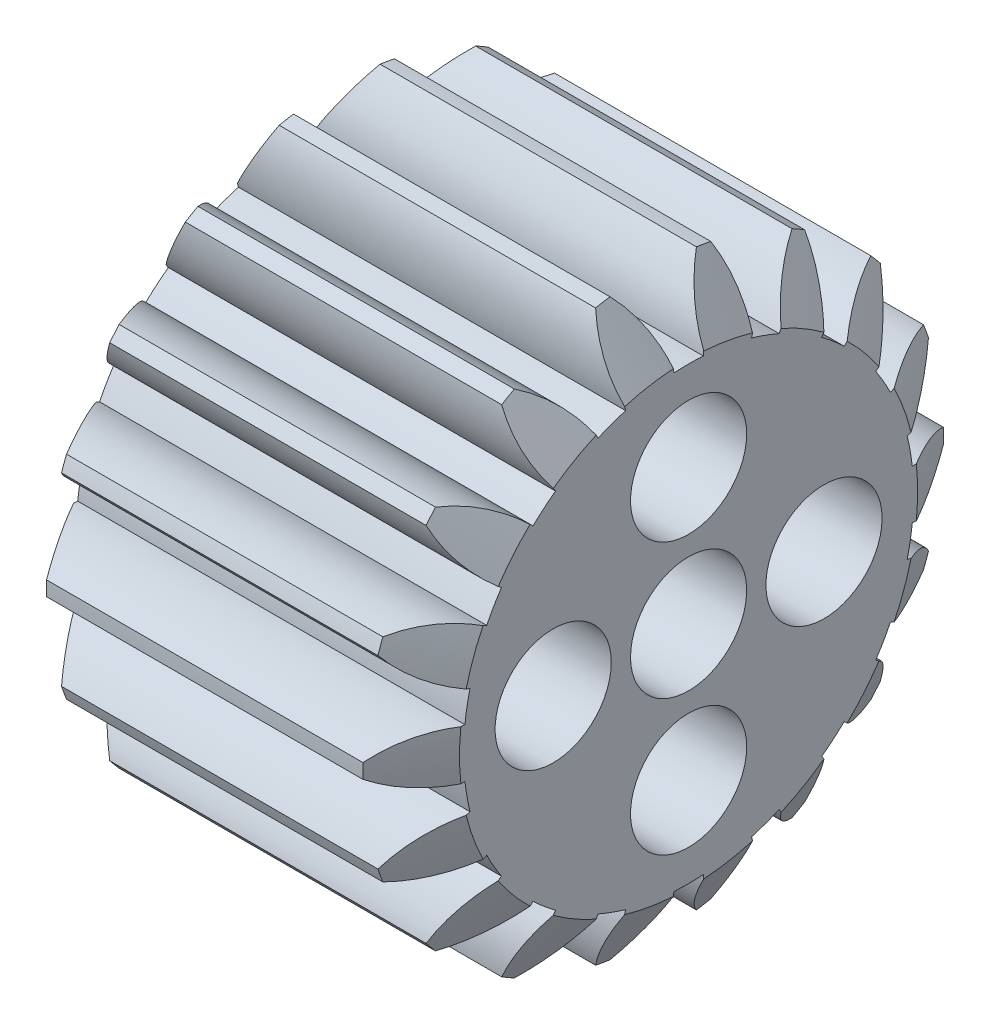
from build123d import *

# Parameters (mm, degrees)
BASPROSKE_W        = 20
BASPROSKE_H        = 15
TOOTHCUT_DEPTH     = 30.154759474
TEETHCUTS_COUNT    = 18
TEETHCUTS_ANGLE    = 340
BORSKE_R           = 3
BORE_DEPTH         = 50.0000508
SKETCH1_R          = 1.75
CUT_EXTRUDE1_DEPTH = 20
SKETCH1_5_R        = 3
SKETCH1_5_R_2      = 1.75
CUT_EXTRUDE3_DEPTH = 15


with BuildPart() as part:
    # BasProSke → Base-Revolve (revolve)
    with BuildSketch(Plane(origin=(0, 0, 0), x_dir=(1, 0, 0), z_dir=(0, 1, 0))):
        with Locations((10, 7.5)):
            Rectangle(BASPROSKE_W, BASPROSKE_H)
    revolve(axis=Axis((-10, 0, 0), (1, 0, 0)))

    # TooCutSke → ToothCut (cut, through all)
    with BuildSketch(Plane(origin=(0, 0, 0), x_dir=(0, 0, -1), z_dir=(1, 0, 0))):
        with BuildLine():
            ThreePointArc((0.759974923, 11.599129886), (0, 11.624), (-0.759974923, 11.599129886))
            ThreePointArc((-0.759974923, 11.599129886), (-1.229186471, 13.354767823), (-2.254227748, 14.855339189))
            ThreePointArc((-2.254227748, 14.855339189), (0, 15.0254), (2.254227748, 14.855339189))
            ThreePointArc((2.254227748, 14.855339189), (1.229186471, 13.354767823), (0.759974923, 11.599129886))
        make_face()
    toothcut = extrude(amount=TOOTHCUT_DEPTH, mode=Mode.SUBTRACT)

    # TeethCuts: ToothCut ×18 about axis
    teethcuts_axis = Axis((-10, 0, 0), (1, 0, 0))
    for i in range(1, TEETHCUTS_COUNT):
        add(toothcut.rotate(teethcuts_axis, i * TEETHCUTS_ANGLE / (TEETHCUTS_COUNT - 1)), mode=Mode.SUBTRACT)

    # BorSke → Bore (cut, symmetric)
    with BuildSketch(Plane(origin=(0, 0, 0), x_dir=(0, 0, -1), z_dir=(1, 0, 0))):
        Circle(BORSKE_R)
    extrude(amount=BORE_DEPTH, both=True, mode=Mode.SUBTRACT)

    # Sketch1 → Cut-Extrude1 (cut)
    with BuildSketch(Plane(origin=(20, 0, 0), x_dir=(0, 0, -1), z_dir=(1, 0, 0))):
        with Locations((6.994644099, -0.273825031)):
            Circle(SKETCH1_R)
        with Locations((-6.994644099, 0.273825031)):
            Circle(SKETCH1_R)
        with Locations((0, 7.000001873)):
            Circle(SKETCH1_R)
        with Locations((0, -7.000001873)):
            Circle(SKETCH1_R)
    extrude(amount=-CUT_EXTRUDE1_DEPTH, mode=Mode.SUBTRACT)

    # Sketch1<5> → Cut-Extrude3 (cut)
    # profile 1 of 4: a face of its own
    with BuildSketch(Plane(origin=(20, 0, 0), x_dir=(0, 0, -1), z_dir=(1, 0, 0))):
        with Locations((0, -7.000001873)):
            Circle(SKETCH1_5_R)
        with Locations((0, -7.000001873)):
            Circle(SKETCH1_5_R_2, mode=Mode.SUBTRACT)
    # profile 2 of 4: a face of its own
    with BuildSketch(Plane(origin=(20, 0, 0), x_dir=(0, 0, -1), z_dir=(1, 0, 0))):
        with Locations((6.994644099, -0.273825031)):
            Circle(SKETCH1_5_R)
        with Locations((6.994644099, -0.273825031)):
            Circle(SKETCH1_5_R_2, mode=Mode.SUBTRACT)
    # profile 3 of 4: a face of its own
    with BuildSketch(Plane(origin=(20, 0, 0), x_dir=(0, 0, -1), z_dir=(1, 0, 0))):
        with Locations((0, 7.000001873)):
            Circle(SKETCH1_5_R)
        with Locations((0, 7.000001873)):
            Circle(SKETCH1_5_R_2, mode=Mode.SUBTRACT)
    # profile 4 of 4: a face of its own
    with BuildSketch(Plane(origin=(20, 0, 0), x_dir=(0, 0, -1), z_dir=(1, 0, 0))):
        with Locations((-6.994644099, 0.273825031)):
            Circle(SKETCH1_5_R)
        with Locations((-6.994644099, 0.273825031)):
            Circle(SKETCH1_5_R_2, mode=Mode.SUBTRACT)
    extrude(amount=-CUT_EXTRUDE3_DEPTH, mode=Mode.SUBTRACT)

    # Sketch2 → Cut-Revolve1 (revolve, cut)
    with BuildSketch(Plane(origin=(0, 0, 0), x_dir=(1, 0, 0), z_dir=(0, 0, -1))):
        Polygon((0, 15.032908379), (1.847520861, 15.032908379), (0, 11.832908379), align=None)
        Polygon((20, 11.832908379), (20, 15.032908379), (18.152479139, 15.032908379), align=None)
    revolve(axis=Axis((0, 0, 0), (1, 0, 0)), mode=Mode.SUBTRACT)


solid = part.part
